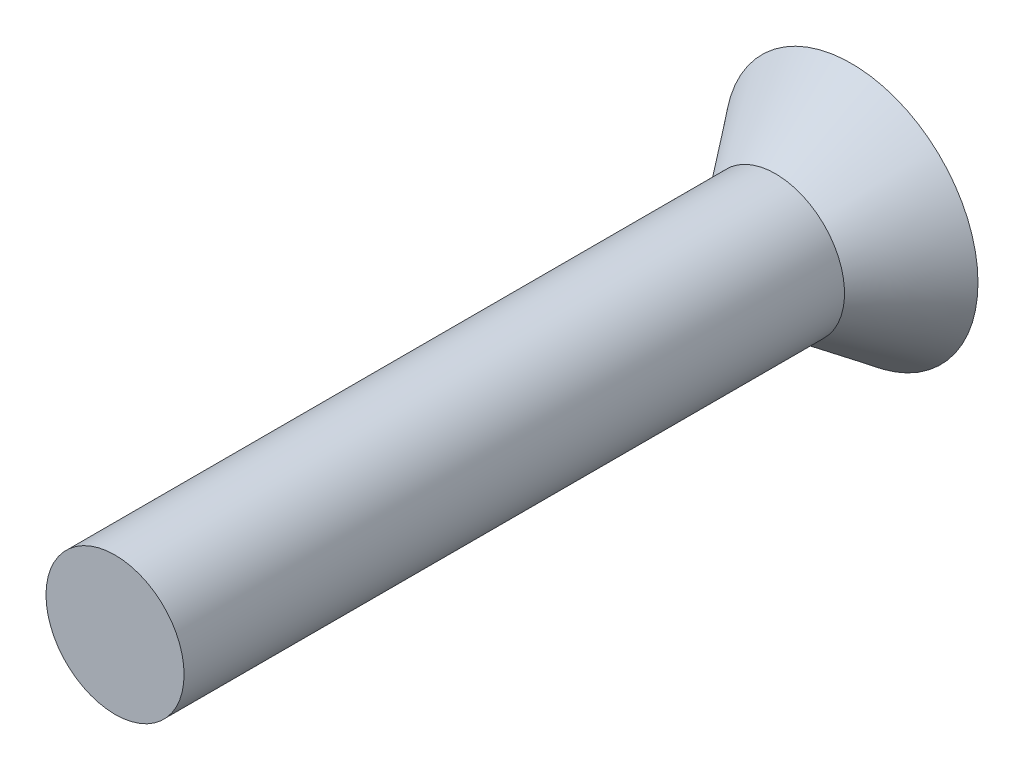
from build123d import *

# Parameters (mm, degrees)
SKETCH_1_R      = 1.5
EXTRUDE_1_DEPTH = 16


with BuildPart() as part:
    # 草图1 → 凸台-拉伸1 (new body)
    with BuildSketch(Plane.XY):
        Circle(SKETCH_1_R)
    extrude(amount=EXTRUDE_1_DEPTH)

    # 草图2 → 旋转1 (revolve)
    with BuildSketch(Plane(origin=(0, 0, 0), x_dir=(1, 0, 0), z_dir=(0, 1, 0)), mode=Mode.PRIVATE) as revolve_1_sk:
        Polygon((1.5, 0), (2.75, 0), (1.5, -1.65), align=None)
    revolve(revolve_1_sk.sketch.rotate(Axis((0, 0, 0), (0, 0, 1)), 180), axis=Axis((0, 0, 0), (0, 0, 1)))


solid = part.part
